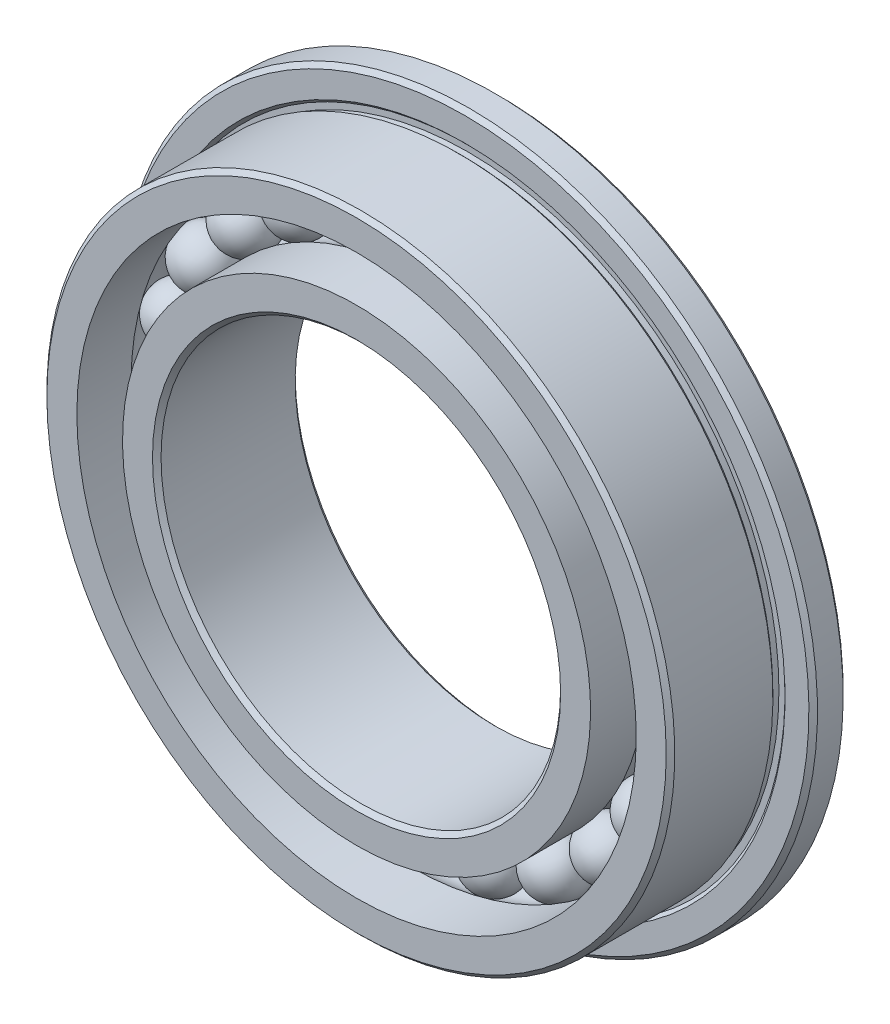
from build123d import *

# Parameters (mm, degrees)
FILLET1_SIZE      = 0.075
FILLET2_SIZE      = 0.075
CIRPATTERN3_COUNT = 24


with BuildPart() as part:
    # Sketch2 → Revolve1 (revolve)
    with BuildSketch(Plane(origin=(0, 0, 0), x_dir=(0, 0, -1), z_dir=(1, 0, 0)), mode=Mode.PRIVATE) as revolve1_sk:
        with BuildLine():
            Line((1.25, 6.1), (0.65, 6.1))
            Line((0.65, 6.1), (0.65, 5.606066017))
            Line((0.65, 5.606066017), (0.703033009, 5.553033009))
            Line((0.703033009, 5.553033009), (0.703033009, 5.446966991))
            Line((0.703033009, 5.446966991), (0.596966991, 5.446966991))
            Line((0.596966991, 5.446966991), (0.543933983, 5.5))
            Line((0.543933983, 5.5), (-1.25, 5.5))
            Line((-1.25, 5.5), (-1.25, 4.9))
            Line((-1.25, 4.9), (-0.3, 4.9))
            ThreePointArc((-0.3, 4.9), (0, 5), (0.3, 4.9))
            Line((0.3, 4.9), (1.25, 4.9))
            Line((1.25, 4.9), (1.25, 6.1))
        make_face()
        with BuildLine():
            Line((1.25, 3.5), (-1.25, 3.5))
            Line((-1.25, 3.5), (-1.25, 4.1))
            Line((-1.25, 4.1), (-0.3, 4.1))
            ThreePointArc((-0.3, 4.1), (0, 4), (0.3, 4.1))
            Line((0.3, 4.1), (1.25, 4.1))
            Line((1.25, 4.1), (1.25, 3.5))
        make_face()
    revolve(revolve1_sk.sketch.rotate(Axis((0, 0, 0), (0, 0, -1)), 180), axis=Axis((0, 0, 0), (0, 0, -1)))

    # Fillet1
    fillet1_edges = [part.edges().sort_by_distance(p)[0] for p in [
        (0, 5.5, 1.25),
        (0, 6.1, -1.25),
        (0, 6.1, -0.65),
    ]]
    chamfer(fillet1_edges, length=FILLET1_SIZE)

    # Fillet2
    fillet2_edges = [part.edges().sort_by_distance(p)[0] for p in [
        (0, 3.5, -1.25),
        (0, 3.5, 1.25),
    ]]
    chamfer(fillet2_edges, length=FILLET2_SIZE)


with BuildPart() as body_2:
    # Sketch7 → Revolve3 (revolve)
    with BuildSketch(Plane.XY):
        with BuildLine():
            Line((0, 5), (0, 4))
            ThreePointArc((0, 4), (-0.5, 4.5), (0, 5))
        make_face()
    revolve(axis=Axis((0, 5, 0), (0, -1, 0)))


with BuildPart() as cirpattern3_1:
    # CirPattern3: pattern copy
    add(body_2.part.rotate(Axis((0, 0, 0), (0, 0, 1)), 1 * 360 / CIRPATTERN3_COUNT))


with BuildPart() as cirpattern3_2:
    # CirPattern3: pattern copy
    add(body_2.part.rotate(Axis((0, 0, 0), (0, 0, 1)), 2 * 360 / CIRPATTERN3_COUNT))


with BuildPart() as cirpattern3_3:
    # CirPattern3: pattern copy
    add(body_2.part.rotate(Axis((0, 0, 0), (0, 0, 1)), 3 * 360 / CIRPATTERN3_COUNT))


with BuildPart() as cirpattern3_4:
    # CirPattern3: pattern copy
    add(body_2.part.rotate(Axis((0, 0, 0), (0, 0, 1)), 4 * 360 / CIRPATTERN3_COUNT))


with BuildPart() as cirpattern3_5:
    # CirPattern3: pattern copy
    add(body_2.part.rotate(Axis((0, 0, 0), (0, 0, 1)), 5 * 360 / CIRPATTERN3_COUNT))


with BuildPart() as cirpattern3_6:
    # CirPattern3: pattern copy
    add(body_2.part.rotate(Axis((0, 0, 0), (0, 0, 1)), 6 * 360 / CIRPATTERN3_COUNT))


with BuildPart() as cirpattern3_7:
    # CirPattern3: pattern copy
    add(body_2.part.rotate(Axis((0, 0, 0), (0, 0, 1)), 7 * 360 / CIRPATTERN3_COUNT))


with BuildPart() as cirpattern3_8:
    # CirPattern3: pattern copy
    add(body_2.part.rotate(Axis((0, 0, 0), (0, 0, 1)), 8 * 360 / CIRPATTERN3_COUNT))


with BuildPart() as cirpattern3_9:
    # CirPattern3: pattern copy
    add(body_2.part.rotate(Axis((0, 0, 0), (0, 0, 1)), 9 * 360 / CIRPATTERN3_COUNT))


with BuildPart() as cirpattern3_10:
    # CirPattern3: pattern copy
    add(body_2.part.rotate(Axis((0, 0, 0), (0, 0, 1)), 10 * 360 / CIRPATTERN3_COUNT))


with BuildPart() as cirpattern3_11:
    # CirPattern3: pattern copy
    add(body_2.part.rotate(Axis((0, 0, 0), (0, 0, 1)), 11 * 360 / CIRPATTERN3_COUNT))


with BuildPart() as cirpattern3_12:
    # CirPattern3: pattern copy
    add(body_2.part.rotate(Axis((0, 0, 0), (0, 0, 1)), 12 * 360 / CIRPATTERN3_COUNT))


with BuildPart() as cirpattern3_13:
    # CirPattern3: pattern copy
    add(body_2.part.rotate(Axis((0, 0, 0), (0, 0, 1)), 13 * 360 / CIRPATTERN3_COUNT))


with BuildPart() as cirpattern3_14:
    # CirPattern3: pattern copy
    add(body_2.part.rotate(Axis((0, 0, 0), (0, 0, 1)), 14 * 360 / CIRPATTERN3_COUNT))


with BuildPart() as cirpattern3_15:
    # CirPattern3: pattern copy
    add(body_2.part.rotate(Axis((0, 0, 0), (0, 0, 1)), 15 * 360 / CIRPATTERN3_COUNT))


with BuildPart() as cirpattern3_16:
    # CirPattern3: pattern copy
    add(body_2.part.rotate(Axis((0, 0, 0), (0, 0, 1)), 16 * 360 / CIRPATTERN3_COUNT))


with BuildPart() as cirpattern3_17:
    # CirPattern3: pattern copy
    add(body_2.part.rotate(Axis((0, 0, 0), (0, 0, 1)), 17 * 360 / CIRPATTERN3_COUNT))


with BuildPart() as cirpattern3_18:
    # CirPattern3: pattern copy
    add(body_2.part.rotate(Axis((0, 0, 0), (0, 0, 1)), 18 * 360 / CIRPATTERN3_COUNT))


with BuildPart() as cirpattern3_19:
    # CirPattern3: pattern copy
    add(body_2.part.rotate(Axis((0, 0, 0), (0, 0, 1)), 19 * 360 / CIRPATTERN3_COUNT))


with BuildPart() as cirpattern3_20:
    # CirPattern3: pattern copy
    add(body_2.part.rotate(Axis((0, 0, 0), (0, 0, 1)), 20 * 360 / CIRPATTERN3_COUNT))


with BuildPart() as cirpattern3_21:
    # CirPattern3: pattern copy
    add(body_2.part.rotate(Axis((0, 0, 0), (0, 0, 1)), 21 * 360 / CIRPATTERN3_COUNT))


with BuildPart() as cirpattern3_22:
    # CirPattern3: pattern copy
    add(body_2.part.rotate(Axis((0, 0, 0), (0, 0, 1)), 22 * 360 / CIRPATTERN3_COUNT))


with BuildPart() as cirpattern3_23:
    # CirPattern3: pattern copy
    add(body_2.part.rotate(Axis((0, 0, 0), (0, 0, 1)), 23 * 360 / CIRPATTERN3_COUNT))


solid = Compound([part.part, body_2.part, cirpattern3_1.part, cirpattern3_2.part, cirpattern3_3.part, cirpattern3_4.part, cirpattern3_5.part, cirpattern3_6.part, cirpattern3_7.part, cirpattern3_8.part, cirpattern3_9.part, cirpattern3_10.part, cirpattern3_11.part, cirpattern3_12.part, cirpattern3_13.part, cirpattern3_14.part, cirpattern3_15.part, cirpattern3_16.part, cirpattern3_17.part, cirpattern3_18.part, cirpattern3_19.part, cirpattern3_20.part, cirpattern3_21.part, cirpattern3_22.part, cirpattern3_23.part])
